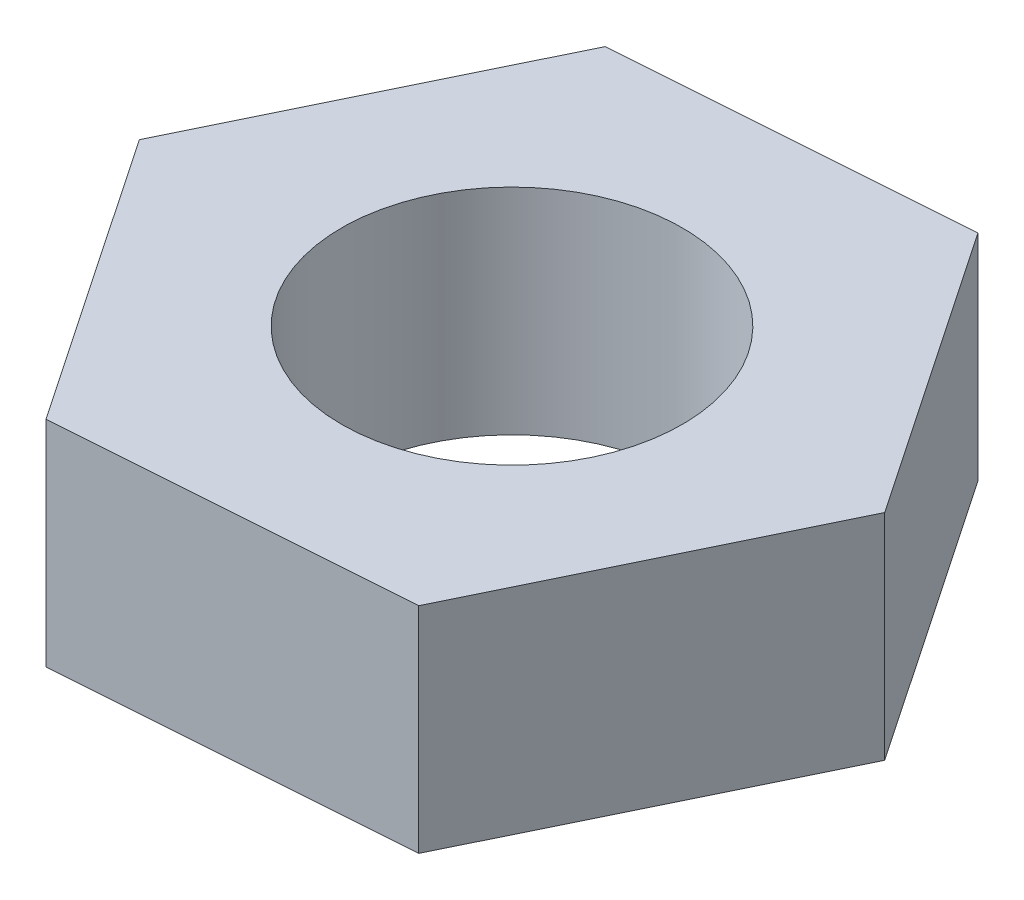
from build123d import *

# Parameters (mm, degrees)
SKETCH1_R           = 6.35
BOSS_EXTRUDE1_DEPTH = 8


with BuildPart() as part:
    # Sketch1 → Boss-Extrude1 (new body)
    with BuildSketch(Plane(origin=(0, 0, 0), x_dir=(1, 0, 0), z_dir=(0, 1, 0))):
        Polygon((7.286973477, -10.765687045), (12.966845208, 0.927860625), (5.679871732, 11.69354767), (-7.286973477, 10.765687045), (-12.966845208, -0.927860625), (-5.679871732, -11.69354767), align=None)
        with Locations(Location((0, 0, 0), (0, 0, 270))):
            Circle(SKETCH1_R, mode=Mode.SUBTRACT)
    extrude(amount=BOSS_EXTRUDE1_DEPTH)


solid = part.part
